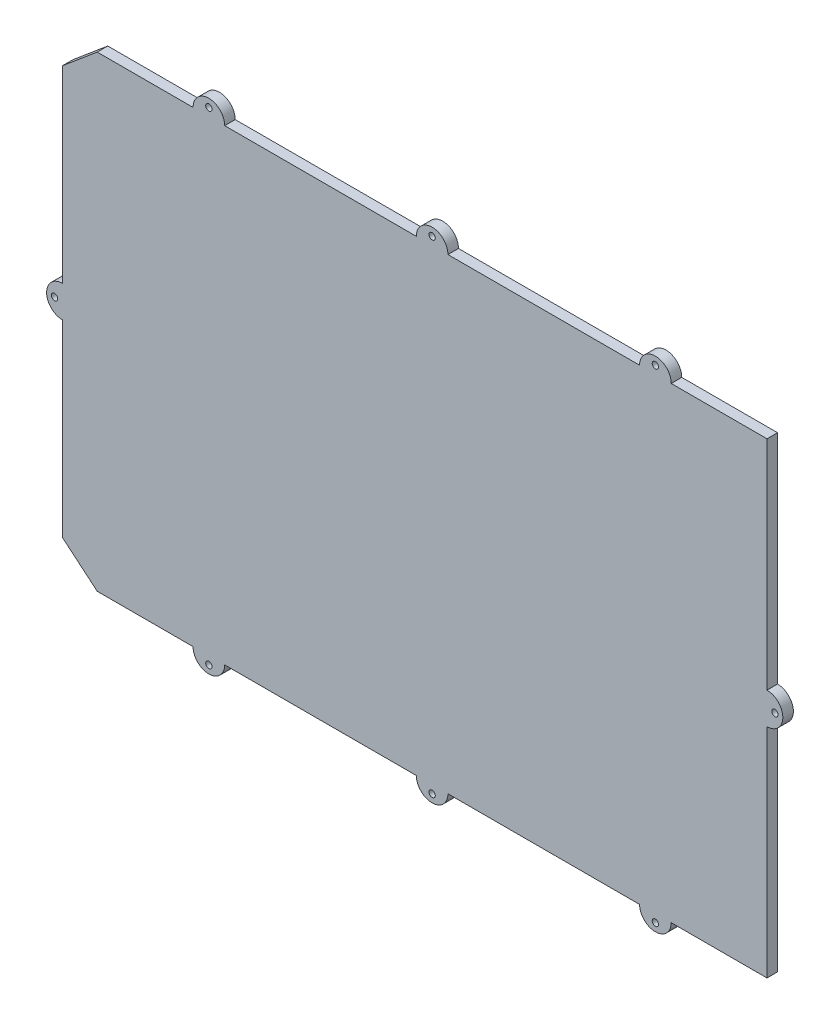
from build123d import *

# Parameters (mm, degrees)
SKETCH1_R           = 3
BOSS_EXTRUDE1_DEPTH = 10


with BuildPart() as part:
    # Sketch1 → Boss-Extrude1 (new body)
    with BuildSketch(Plane.XY):
        with BuildLine():
            Line((319.2, -227.34232335), (319.2, -20.84232335))
            ThreePointArc((319.2, -20.84232335), (334.2, -5.84232335), (319.2, 9.15767665))
            Line((319.2, 9.15767665), (319.2, 215.65767665))
            Line((319.2, 215.65767665), (228.3, 215.65767665))
            ThreePointArc((228.3, 215.65767665), (213.3, 230.65767665), (198.3, 215.65767665))
            Line((198.3, 215.65767665), (16.5, 215.65767665))
            ThreePointArc((16.5, 215.65767665), (1.5, 230.65767665), (-13.5, 215.65767665))
            Line((-13.5, 215.65767665), (-195.3, 215.65767665))
            ThreePointArc((-195.3, 215.65767665), (-210.3, 230.65767665), (-225.3, 215.65767665))
            Line((-225.3, 215.65767665), (-316.2, 215.65767665))
            Line((-316.2, 215.65767665), (-349.2, 187.967388821))
            Line((-349.2, 187.967388821), (-349.2, 9.15767665))
            ThreePointArc((-349.2, 9.15767665), (-364.2, -5.84232335), (-349.2, -20.84232335))
            Line((-349.2, -20.84232335), (-349.2, -199.652035521))
            Line((-349.2, -199.652035521), (-316.2, -227.34232335))
            Line((-316.2, -227.34232335), (-225.3, -227.34232335))
            ThreePointArc((-225.3, -227.34232335), (-210.3, -242.34232335), (-195.3, -227.34232335))
            Line((-195.3, -227.34232335), (-13.5, -227.34232335))
            ThreePointArc((-13.5, -227.34232335), (1.5, -242.34232335), (16.5, -227.34232335))
            Line((16.5, -227.34232335), (198.3, -227.34232335))
            ThreePointArc((198.3, -227.34232335), (213.3, -242.34232335), (228.3, -227.34232335))
            Line((228.3, -227.34232335), (319.2, -227.34232335))
        make_face()
        with Locations((-210.3, 223.15767665)):
            Circle(SKETCH1_R, mode=Mode.SUBTRACT)
        with Locations((1.5, 223.15767665)):
            Circle(SKETCH1_R, mode=Mode.SUBTRACT)
        with Locations((213.3, 223.15767665)):
            Circle(SKETCH1_R, mode=Mode.SUBTRACT)
        with Locations((326.7, -5.84232335)):
            Circle(SKETCH1_R, mode=Mode.SUBTRACT)
        with Locations((-356.7, -5.84232335)):
            Circle(SKETCH1_R, mode=Mode.SUBTRACT)
        with Locations((-210.3, -234.84232335)):
            Circle(SKETCH1_R, mode=Mode.SUBTRACT)
        with Locations((1.5, -234.84232335)):
            Circle(SKETCH1_R, mode=Mode.SUBTRACT)
        with Locations((213.3, -234.84232335)):
            Circle(SKETCH1_R, mode=Mode.SUBTRACT)
    extrude(amount=BOSS_EXTRUDE1_DEPTH)


solid = part.part
